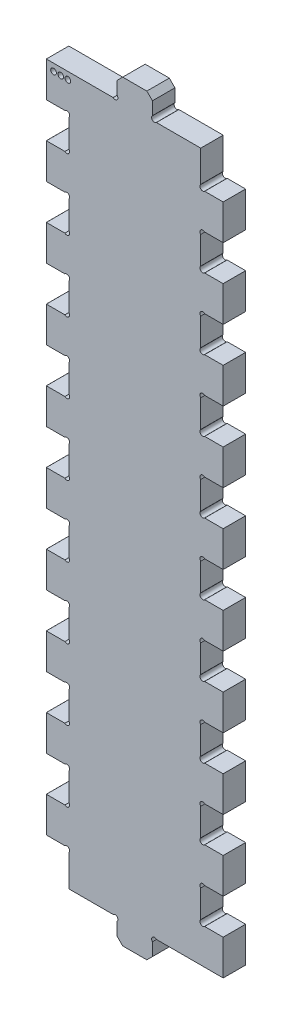
from build123d import *

# Parameters (mm, degrees)
SKETCH1_W           = 50.000000076
SKETCH1_H           = 200.000108
BOSS_EXTRUDE1_DEPTH = 6.35
SKETCH2_W           = 10.0000054
SKETCH2_H           = 6.35
BOSS_EXTRUDE2_DEPTH = 6.35
SKETCH8_W           = 6.35
SKETCH8_H           = 10.0000054
CUT_EXTRUDE6_DEPTH  = 213.416311942
LPATTERN4_COUNT     = 10
LPATTERN4_PITCH     = 20.0000108
SKETCH9_R           = 0.79375
CUT_EXTRUDE7_DEPTH  = 213.416311942
LPATTERN5_COUNT     = 9
LPATTERN5_PITCH     = 20.0000108
SKETCH10_R          = 0.79375
CUT_EXTRUDE8_DEPTH  = 213.416311942
CHAMFER1_SIZE       = 1.5875
SKETCH11_R          = 0.79375
CUT_EXTRUDE10_DEPTH = 213.416311942
SKETCH14_W          = 6.3240118
SKETCH14_H          = 10.0254054
CUT_EXTRUDE13_DEPTH = 213.416311942
LPATTERN7_COUNT     = 10
LPATTERN7_PITCH     = 20.0000108
SKETCH15_R          = 0.79375
CUT_EXTRUDE14_DEPTH = 3.175
LPATTERN8_COUNT     = 3
LPATTERN8_PITCH     = 2.032


with BuildPart() as part:
    # Sketch1 → Boss-Extrude1 (new body)
    with BuildSketch(Plane.XY):
        with Locations((25.000000038, 100.000054)):
            Rectangle(SKETCH1_W, SKETCH1_H)
    extrude(amount=BOSS_EXTRUDE1_DEPTH)

    # Sketch2 → Boss-Extrude2 (add)
    with BuildSketch(Plane.XY):
        with Locations((25.000000038, 203.175108)):
            Rectangle(SKETCH2_W, SKETCH2_H)
        with Locations((25.000000038, -3.175)):
            Rectangle(SKETCH2_W, SKETCH2_H)
    extrude(amount=BOSS_EXTRUDE2_DEPTH)

    # Sketch8 → Cut-Extrude6 (cut, through all)
    with BuildSketch(Plane.XY.offset(6.35)):
        with Locations((3.175, 5.0000027)):
            Rectangle(SKETCH8_W, SKETCH8_H)
        with Locations((46.825000076, 15.0000081)):
            Rectangle(SKETCH8_W, SKETCH8_H)
    cut_extrude6 = extrude(amount=-CUT_EXTRUDE6_DEPTH, mode=Mode.SUBTRACT)

    # LPattern4: Cut-Extrude6 ×10
    with Locations(*[(0, i * LPATTERN4_PITCH, 0) for i in range(1, LPATTERN4_COUNT)]):
        add(cut_extrude6, mode=Mode.SUBTRACT)

    # Sketch9 → Cut-Extrude7 (cut, through all)
    with BuildSketch(Plane.XY.offset(6.35)):
        with Locations((5.788733992, 29.438750192)):
            Circle(SKETCH9_R)
        with Locations((5.788733992, 20.561276808)):
            Circle(SKETCH9_R)
        with Locations((44.211266084, 19.438744792)):
            Circle(SKETCH9_R)
        with Locations((44.211266084, 10.561271408)):
            Circle(SKETCH9_R)
    cut_extrude7 = extrude(amount=-CUT_EXTRUDE7_DEPTH, mode=Mode.SUBTRACT)

    # LPattern5: Cut-Extrude7 ×9
    with Locations(*[(0, i * LPATTERN5_PITCH, 0) for i in range(1, LPATTERN5_COUNT)]):
        add(cut_extrude7, mode=Mode.SUBTRACT)

    # Sketch10 → Cut-Extrude8 (cut, through all)
    with BuildSketch(Plane.XY.offset(6.35)):
        with Locations((5.788733992, 9.438739392)):
            Circle(SKETCH10_R)
        with Locations((44.211266084, 190.561368608)):
            Circle(SKETCH10_R)
    extrude(amount=-CUT_EXTRUDE8_DEPTH, mode=Mode.SUBTRACT)

    # Chamfer1
    chamfer1_edges = [part.edges().sort_by_distance(p)[0] for p in [
        (30.000002738, 206.350108, 3.175),
        (19.999997338, 206.350108, 3.175),
        (19.999997338, -6.35, 3.175),
        (30.000002738, -6.35, 3.175),
    ]]
    chamfer(chamfer1_edges, length=CHAMFER1_SIZE)

    # Sketch11 → Cut-Extrude10 (cut, through all)
    with BuildSketch(Plane.XY):
        with Locations((19.43873133, 200.561374008)):
            Circle(SKETCH11_R)
        with Locations((30.561268746, 200.561374008)):
            Circle(SKETCH11_R)
        with Locations((19.43873133, -0.561266008)):
            Circle(SKETCH11_R)
        with Locations((30.561268746, -0.561266008)):
            Circle(SKETCH11_R)
    extrude(amount=CUT_EXTRUDE10_DEPTH, mode=Mode.SUBTRACT)

    # Sketch14 → Cut-Extrude13 (cut, through all)
    with BuildSketch(Plane.XY.offset(6.35)):
        with Locations((3.175, 5.0000027)):
            Rectangle(SKETCH14_W, SKETCH14_H)
        with Locations((46.825000076, 15.0000081)):
            Rectangle(SKETCH14_W, SKETCH14_H)
    cut_extrude13 = extrude(amount=-CUT_EXTRUDE13_DEPTH, mode=Mode.SUBTRACT)

    # LPattern7: Cut-Extrude13 ×10
    with Locations(*[(0, i * LPATTERN7_PITCH, 0) for i in range(1, LPATTERN7_COUNT)]):
        add(cut_extrude13, mode=Mode.SUBTRACT)

    # Sketch15 → Cut-Extrude14 (cut)
    with BuildSketch(Plane.XY.offset(6.35)):
        with Locations((2.032, 197.968108)):
            Circle(SKETCH15_R)
    cut_extrude14 = extrude(amount=-CUT_EXTRUDE14_DEPTH, mode=Mode.SUBTRACT)

    # LPattern8: Cut-Extrude14 ×3
    with Locations(*[(i * LPATTERN8_PITCH, 0, 0) for i in range(1, LPATTERN8_COUNT)]):
        add(cut_extrude14, mode=Mode.SUBTRACT)


solid = part.part
